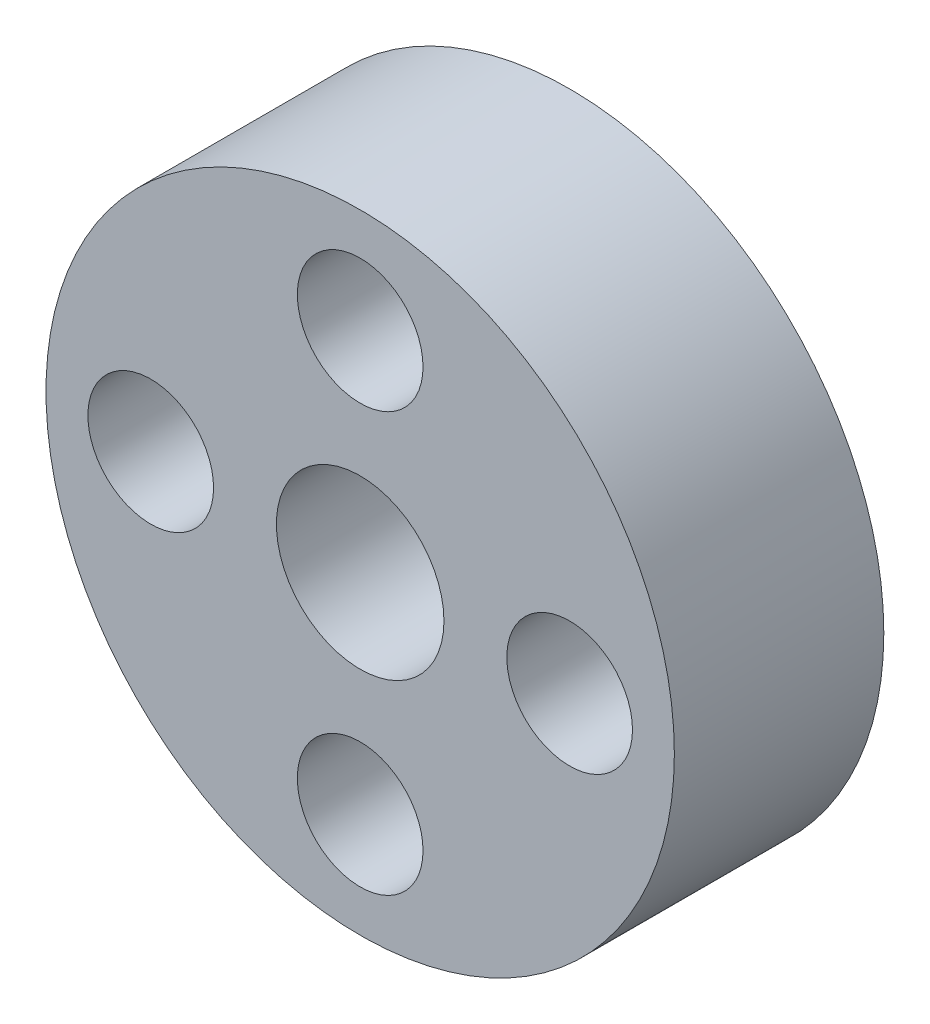
from build123d import *

# Parameters (mm, degrees)
SKETCH1_R           = 15
SKETCH1_R_2         = 3
SKETCH1_R_3         = 4
BOSS_EXTRUDE1_DEPTH = 10


with BuildPart() as part:
    # Sketch1 → Boss-Extrude1 (new body)
    with BuildSketch(Plane.XY):
        Circle(SKETCH1_R)
        with Locations((0, 10)):
            Circle(SKETCH1_R_2, mode=Mode.SUBTRACT)
        with Locations((10, 0)):
            Circle(SKETCH1_R_2, mode=Mode.SUBTRACT)
        with Locations((0, -10)):
            Circle(SKETCH1_R_2, mode=Mode.SUBTRACT)
        with Locations((-10, 0)):
            Circle(SKETCH1_R_2, mode=Mode.SUBTRACT)
        Circle(SKETCH1_R_3, mode=Mode.SUBTRACT)
    extrude(amount=BOSS_EXTRUDE1_DEPTH)


solid = part.part
